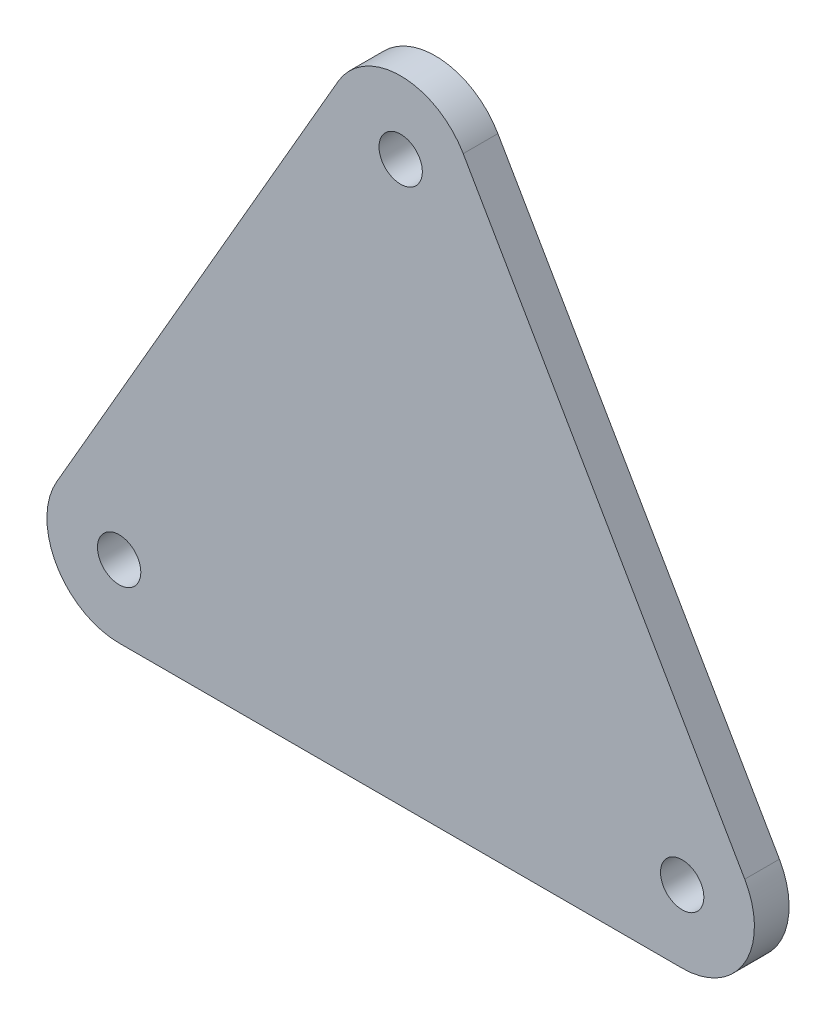
from build123d import *

# Parameters (mm, degrees)
SKETCH1_R           = 1.5
BOSS_EXTRUDE1_DEPTH = 2.4


with BuildPart() as part:
    # Sketch1 → Boss-Extrude1 (new body)
    with BuildSketch(Plane.XY):
        with BuildLine():
            Line((-23.815698604, -8.75), (-4.330127019, 25))
            ThreePointArc((-4.330127019, 25), (0, 27.5), (4.330127019, 25))
            Line((4.330127019, 25), (23.815698604, -8.75))
            ThreePointArc((23.815698604, -8.75), (23.815698604, -13.75), (19.485571585, -16.25))
            Line((19.485571585, -16.25), (-19.485571585, -16.25))
            ThreePointArc((-19.485571585, -16.25), (-23.815698604, -13.75), (-23.815698604, -8.75))
        make_face()
        with Locations((0, 22.5)):
            Circle(SKETCH1_R, mode=Mode.SUBTRACT)
        with Locations((19.485571585, -11.25)):
            Circle(SKETCH1_R, mode=Mode.SUBTRACT)
        with Locations((-19.485571585, -11.25)):
            Circle(SKETCH1_R, mode=Mode.SUBTRACT)
    extrude(amount=BOSS_EXTRUDE1_DEPTH)


solid = part.part
